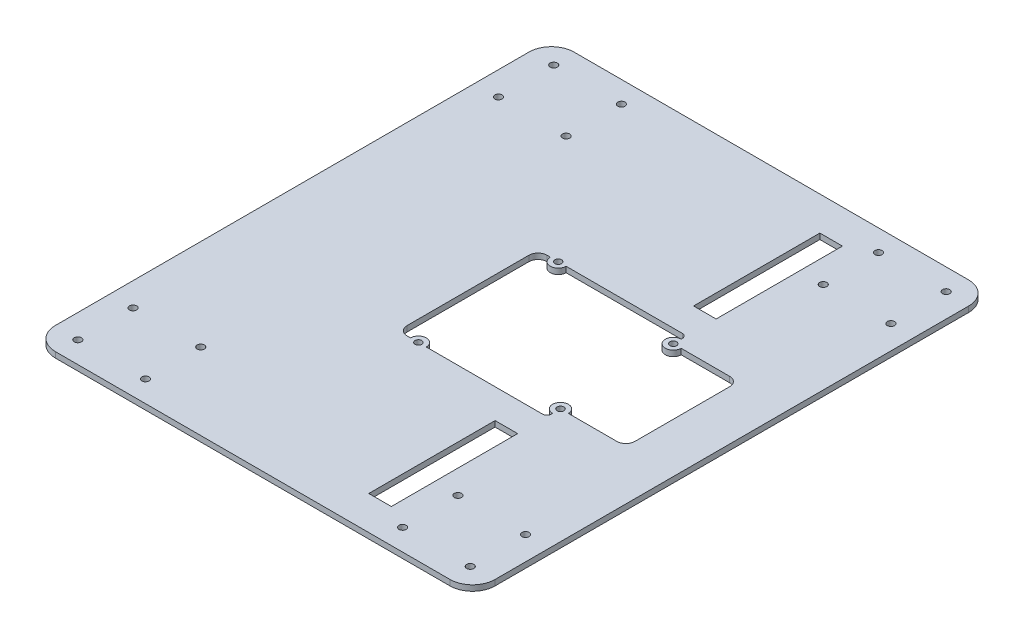
from build123d import *

# Parameters (mm, degrees)
SKETCH_1_W          = 51
SKETCH_1_H          = 44
SKETCH_1_R          = 1.6
SKETCH_1_W_2        = 10
SKETCH_1_H_2        = 15
EXTRUDE_1_DEPTH     = 2.5
SKETCH_2_R          = 1.5
CUT_EXTRUDE_1_DEPTH = 2.5
FILLET_1_R          = 10
FILLET_2_R          = 4
FILLET_3_R          = 2


with BuildPart() as part:
    # 草图1 → 凸台-拉伸1 (new body)
    # profile 1 of 7: a face of its own
    with BuildSketch(Plane(origin=(0, 0, 0), x_dir=(1, 0, 0), z_dir=(0, 1, 0))):
        Polygon((134, 0), (134, 15), (134, 71), (144, 71), (144, 44), (195, 44), (195, 186), (144, 186), (144, 159), (134, 159), (134, 215), (134, 230), (51, 230), (51, 186), (0, 186), (0, 44), (51, 44), (51, 0), align=None)
    # profile 2 of 7: a face of its own
    with BuildSketch(Plane(origin=(0, 0, 0), x_dir=(1, 0, 0), z_dir=(0, 1, 0))):
        with Locations((25.5, 208)):
            Rectangle(SKETCH_1_W, SKETCH_1_H)
        with Locations(Location((10.5, 196, 0), (0, 0, 270))):
            Circle(SKETCH_1_R, mode=Mode.SUBTRACT)
        with Locations(Location((40.5, 196, 0), (0, 0, 270))):
            Circle(SKETCH_1_R, mode=Mode.SUBTRACT)
        with Locations(Location((10.5, 220.5, 0), (0, 0, 270))):
            Circle(SKETCH_1_R, mode=Mode.SUBTRACT)
        with Locations(Location((40.5, 220.5, 0), (0, 0, 270))):
            Circle(SKETCH_1_R, mode=Mode.SUBTRACT)
    # profile 3 of 7: a face of its own
    with BuildSketch(Plane(origin=(0, 0, 0), x_dir=(1, 0, 0), z_dir=(0, 1, 0))):
        Polygon((144, 186), (195, 186), (195, 230), (144, 230), (144, 215), align=None)
        with Locations(Location((154.5, 196, 0), (0, 0, 270))):
            Circle(SKETCH_1_R, mode=Mode.SUBTRACT)
        with Locations(Location((184.5, 196, 0), (0, 0, 270))):
            Circle(SKETCH_1_R, mode=Mode.SUBTRACT)
        with Locations(Location((154.5, 220.5, 0), (0, 0, 270))):
            Circle(SKETCH_1_R, mode=Mode.SUBTRACT)
        with Locations(Location((184.5, 220.5, 0), (0, 0, 270))):
            Circle(SKETCH_1_R, mode=Mode.SUBTRACT)
    # profile 4 of 7: a face of its own
    with BuildSketch(Plane(origin=(0, 0, 0), x_dir=(1, 0, 0), z_dir=(0, 1, 0))):
        with Locations((25.5, 22)):
            Rectangle(SKETCH_1_W, SKETCH_1_H)
        with Locations(Location((10.5, 9.5, 0), (0, 0, 270))):
            Circle(SKETCH_1_R, mode=Mode.SUBTRACT)
        with Locations(Location((40.5, 9.5, 0), (0, 0, 270))):
            Circle(SKETCH_1_R, mode=Mode.SUBTRACT)
        with Locations(Location((10.5, 34, 0), (0, 0, 270))):
            Circle(SKETCH_1_R, mode=Mode.SUBTRACT)
        with Locations(Location((40.5, 34, 0), (0, 0, 270))):
            Circle(SKETCH_1_R, mode=Mode.SUBTRACT)
    # profile 5 of 7: a face of its own
    with BuildSketch(Plane(origin=(0, 0, 0), x_dir=(1, 0, 0), z_dir=(0, 1, 0))):
        Polygon((144, 44), (144, 15), (144, 0), (195, 0), (195, 44), align=None)
        with Locations(Location((154.5, 9.5, 0), (0, 0, 270))):
            Circle(SKETCH_1_R, mode=Mode.SUBTRACT)
        with Locations(Location((184.5, 9.5, 0), (0, 0, 270))):
            Circle(SKETCH_1_R, mode=Mode.SUBTRACT)
        with Locations(Location((154.5, 34, 0), (0, 0, 270))):
            Circle(SKETCH_1_R, mode=Mode.SUBTRACT)
        with Locations(Location((184.5, 34, 0), (0, 0, 270))):
            Circle(SKETCH_1_R, mode=Mode.SUBTRACT)
    # profile 6 of 7: a face of its own
    with BuildSketch(Plane(origin=(0, 0, 0), x_dir=(1, 0, 0), z_dir=(0, 1, 0))):
        with Locations((139, 7.5)):
            Rectangle(SKETCH_1_W_2, SKETCH_1_H_2)
    # profile 7 of 7: a face of its own
    with BuildSketch(Plane(origin=(0, 0, 0), x_dir=(1, 0, 0), z_dir=(0, 1, 0))):
        with Locations((139, 222.5)):
            Rectangle(SKETCH_1_W_2, SKETCH_1_H_2)
    extrude(amount=EXTRUDE_1_DEPTH)

    # 草图2 → 切除-拉伸1 (cut)
    with BuildSketch(Plane(origin=(0, 2.5, 0), x_dir=(1, 0, 0), z_dir=(0, 1, 0))):
        with Locations(Location((87, 84, 0), (0, 0, 270))):
            Circle(SKETCH_2_R)
        with BuildLine():
            ThreePointArc((83.5, 84), (87, 87.5), (90.5, 84))
            Line((90.5, 84), (144, 84))
            Line((144, 84), (144, 86.5))
            ThreePointArc((144, 86.5), (141.525126266, 92.474873734), (147.5, 90))
            Line((147.5, 90), (173, 90))
            Line((173, 90), (173, 140))
            Line((173, 140), (147.5, 140))
            ThreePointArc((147.5, 140), (141.525126266, 137.525126266), (144, 143.5))
            Line((144, 143.5), (144, 146))
            Line((144, 146), (90.5, 146))
            ThreePointArc((90.5, 146), (87, 142.5), (83.5, 146))
            Line((83.5, 146), (78, 146))
            Line((78, 146), (78, 84))
            Line((78, 84), (83.5, 84))
        make_face()
        with Locations(Location((144, 90, 0), (0, 0, 270))):
            Circle(SKETCH_2_R)
        with Locations(Location((144, 140, 0), (0, 0, 270))):
            Circle(SKETCH_2_R)
        with Locations(Location((87, 146, 0), (0, 0, 270))):
            Circle(SKETCH_2_R)
    extrude(amount=-CUT_EXTRUDE_1_DEPTH, mode=Mode.SUBTRACT)

    # 圆角1
    fillet_1_edges = [part.edges().sort_by_distance(p)[0] for p in [
        (0, 1.25, 0),
        (0, 1.25, -230),
        (195, 1.25, -230),
        (195, 1.25, 0),
    ]]
    fillet(fillet_1_edges, radius=FILLET_1_R)

    # 圆角2
    fillet_2_edges = [part.edges().sort_by_distance(p)[0] for p in [
        (78, 1.25, -146),
        (78, 1.25, -84),
        (173, 1.25, -90),
        (173, 1.25, -140),
    ]]
    fillet(fillet_2_edges, radius=FILLET_2_R)

    # 圆角3
    fillet_3_edges = [part.edges().sort_by_distance(p)[0] for p in [
        (144, 1.25, -84),
        (144, 1.25, -146),
    ]]
    fillet(fillet_3_edges, radius=FILLET_3_R)


solid = part.part
